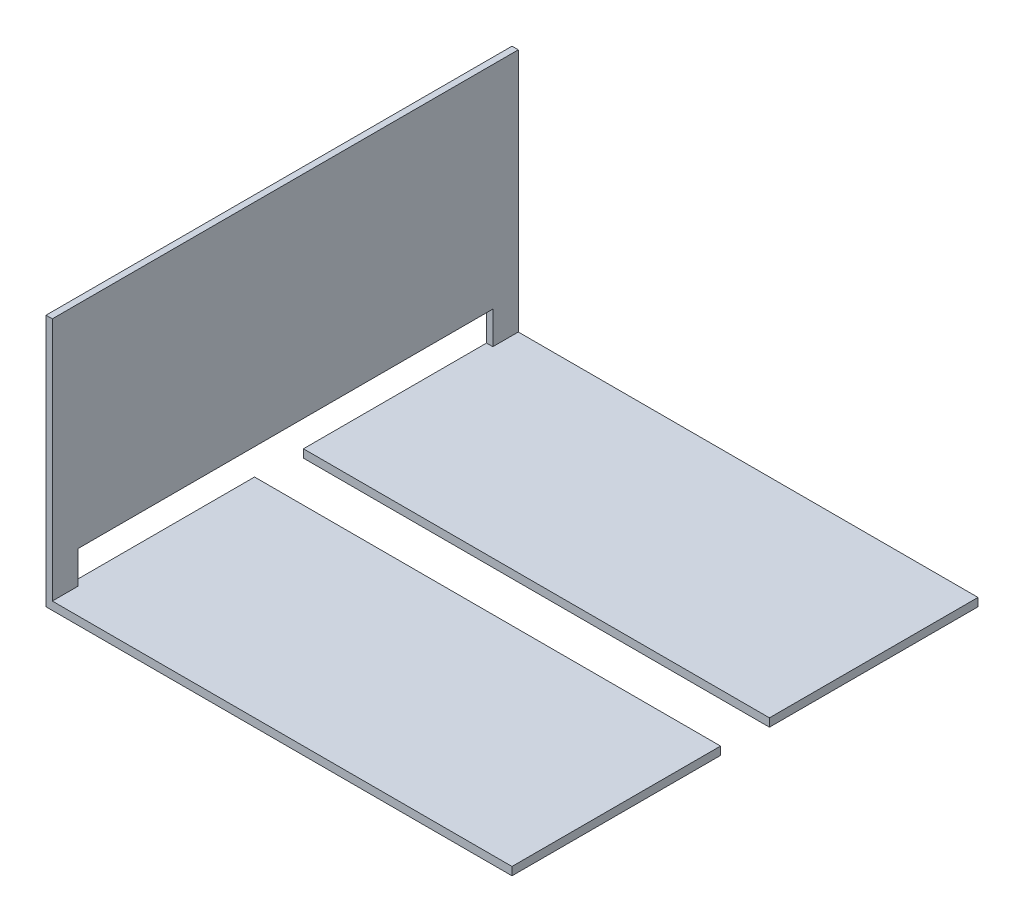
from build123d import *

# Parameters (mm, degrees)
SKETCH1_W           = 286
SKETCH1_H           = 286
BOSS_EXTRUDE1_DEPTH = 5
SKETCH4_R           = 2.499853141
SKETCH4_R_2         = 2.499999298
SKETCH4_R_3         = 2.499896797
CUT_EXTRUDE1_DEPTH  = 4
SKETCH5_W           = 286
SKETCH5_H           = 30
CUT_EXTRUDE2_DEPTH  = 203.29434001
SKETCH6_W           = 3.876379433
SKETCH6_H           = 286
BOSS_EXTRUDE2_DEPTH = 150
SKETCH7_W           = 254.74073144
SKETCH7_H           = 20
CUT_EXTRUDE3_DEPTH  = 353.232504579


with BuildPart() as part:
    # Sketch1 → Boss-Extrude1 (new body)
    with BuildSketch(Plane(origin=(0, 0, 0), x_dir=(1, 0, 0), z_dir=(0, 1, 0))):
        Rectangle(SKETCH1_W, SKETCH1_H)
    extrude(amount=BOSS_EXTRUDE1_DEPTH)

    # Sketch4 → Cut-Extrude1 (cut)
    with BuildSketch(Plane(origin=(0, 0, 0), x_dir=(-1, 0, 0), z_dir=(0, -1, 0))):
        with Locations(Location((132.573463178, -80.981198503, 0), (0, 0, 90))):
            Circle(SKETCH4_R)
        with Locations(Location((132.573463178, -36.981198619, 0), (0, 0, 90))):
            Circle(SKETCH4_R_2)
        with Locations(Location((132.569572232, 36.981198719, 0), (0, 0, 90))):
            Circle(SKETCH4_R_3)
        with Locations(Location((132.569572232, 80.981198603, 0), (0, 0, 90))):
            Circle(SKETCH4_R_3)
    extrude(amount=-CUT_EXTRUDE1_DEPTH, mode=Mode.SUBTRACT)

    # Sketch5 → Cut-Extrude2 (cut, through all)
    with BuildSketch(Plane(origin=(0, 5, 0), x_dir=(1, 0, 0), z_dir=(0, 1, 0))):
        Rectangle(SKETCH5_W, SKETCH5_H)
    extrude(amount=-CUT_EXTRUDE2_DEPTH, mode=Mode.SUBTRACT)


with BuildPart() as cut_extrude2_piece_1:
    # of the separate pieces the step leaves, piece 1, a body of its own (cut_extrude2_pieces)
    add(part.part.solids().sort_by_distance((-143, 0, -143))[0])



with BuildPart() as cut_extrude2_piece_2:
    # of the separate pieces the step leaves, piece 2, a body of its own (cut_extrude2_pieces)
    add(part.part.solids().sort_by_distance((-143, 0, 143))[0])


with BuildPart() as cut_extrude2_piece_1_1:
    add(cut_extrude2_piece_1.part)

    add(cut_extrude2_piece_2.part)  # Boss-Extrude2 merges Cut-Extrude2 piece 2
    # Sketch6 → Boss-Extrude2 (add)
    with BuildSketch(Plane(origin=(0, 5, 0), x_dir=(1, 0, 0), z_dir=(0, 1, 0))):
        with Locations((-141.061810283, 0)):
            Rectangle(SKETCH6_W, SKETCH6_H)
    extrude(amount=BOSS_EXTRUDE2_DEPTH)

    # Sketch7 → Cut-Extrude3 (cut, through all)
    with BuildSketch(Plane(origin=(-139.123620567, 0, 0), x_dir=(0, 0, -1), z_dir=(1, 0, 0))):
        with Locations((0, 15)):
            Rectangle(SKETCH7_W, SKETCH7_H)
    extrude(amount=-CUT_EXTRUDE3_DEPTH, mode=Mode.SUBTRACT)


solid = cut_extrude2_piece_1_1.part
